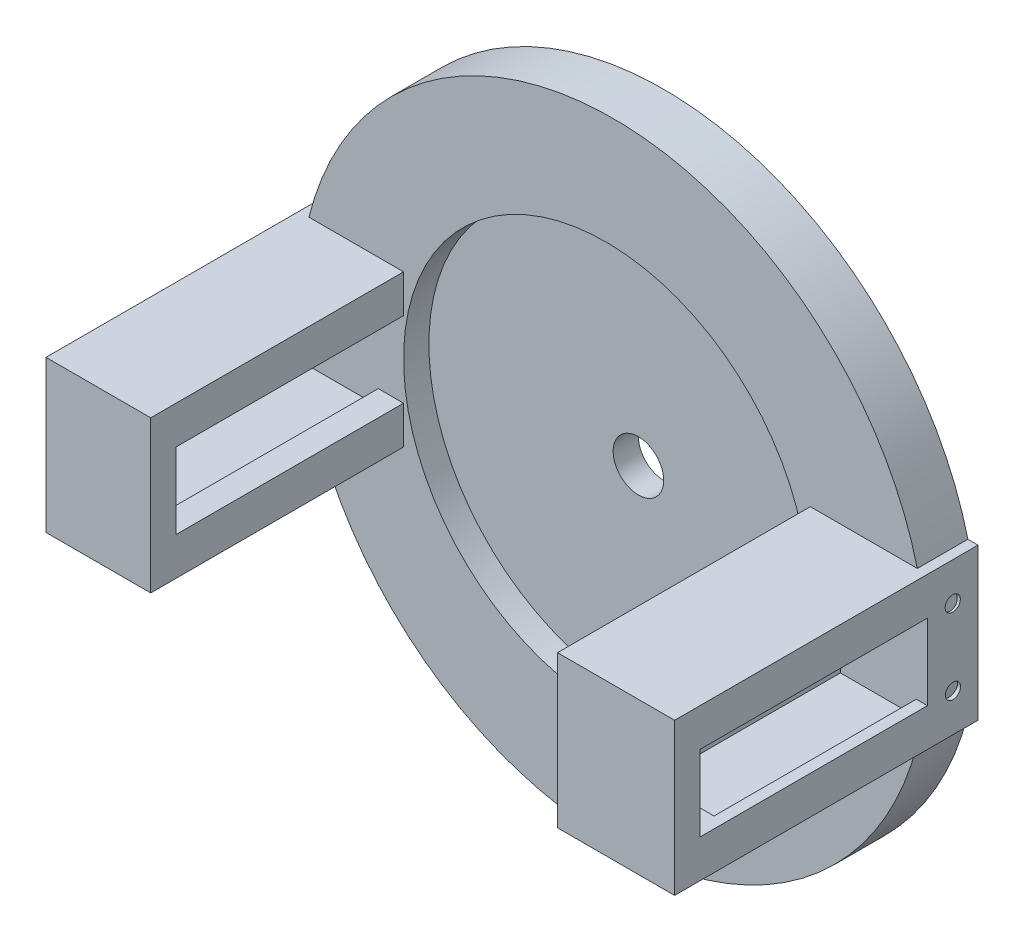
from build123d import *

# Parameters (mm, degrees)
IZIM1_R                     = 62
Y_KSEKLIK_EKSTR_ZYON1_DEPTH = 10
IZIM2_W                     = 60
IZIM2_H                     = 30
IZIM2_R                     = 1.5
IZIM2_W_2                   = 45
IZIM2_H_2                   = 15
Y_KSEKLIK_EKSTR_ZYON2_DEPTH = 25
DAIRESEL_KAPLAMA1_COUNT     = 2
DAIRESEL_KAPLAMA1_ANGLE     = 180
KES_EKSTR_ZYON1_START       = -3
IZIM4_W                     = 15
IZIM4_H                     = 40
KES_EKSTR_ZYON1_DEPTH       = 21
DAIRESEL_KAPLAMA2_COUNT     = 2
IZIM6_W                     = 4.288055231
IZIM6_H                     = 60
IZIM6_W_2                   = 1.841875029
KES_EKSTR_ZYON3_DEPTH       = 20
IZIM5_R                     = 40
KES_EKSTR_ZYON4_DEPTH       = 5
IZIM7_R                     = 5
KES_EKSTR_ZYON5_DEPTH       = 10


with BuildPart() as part:
    # Çizim1 → Yükseklik-Ekstrüzyon1 (new body)
    with BuildSketch(Plane.XY):
        Circle(IZIM1_R)
    extrude(amount=Y_KSEKLIK_EKSTR_ZYON1_DEPTH)

    # Çizim2 → Yükseklik-Ekstrüzyon2 (add)
    with BuildSketch(Plane(origin=(64, 0, 0), x_dir=(0, 0, -1), z_dir=(1, 0, 0))):
        with Locations((-30, 0)):
            Rectangle(IZIM2_W, IZIM2_H)
        with Locations((-5, 7.5)):
            Circle(IZIM2_R, mode=Mode.SUBTRACT)
        with Locations((-4.950442225, -7.5)):
            Circle(IZIM2_R, mode=Mode.SUBTRACT)
        with Locations((-32.5, 0)):
            Rectangle(IZIM2_W_2, IZIM2_H_2, mode=Mode.SUBTRACT)
    y_kseklik_ekstr_zyon2 = extrude(amount=-Y_KSEKLIK_EKSTR_ZYON2_DEPTH)

    # Dairesel Kaplama1: Yükseklik-Ekstrüzyon2 ×2 about axis
    dairesel_kaplama1_axis = Axis((-1.223090101, 0, 0), (0, 0, 1))
    for i in range(1, DAIRESEL_KAPLAMA1_COUNT):
        add(y_kseklik_ekstr_zyon2.rotate(dairesel_kaplama1_axis, i * DAIRESEL_KAPLAMA1_ANGLE / (DAIRESEL_KAPLAMA1_COUNT - 1)))

    # Çizim4 → Kes-Ekstrüzyon1 (cut)
    with BuildSketch(Plane.XZ.offset(-7.5).offset(KES_EKSTR_ZYON1_START)):
        with Locations((-53.946180202, 30)):
            Rectangle(IZIM4_W, IZIM4_H)
    kes_ekstr_zyon1 = extrude(amount=KES_EKSTR_ZYON1_DEPTH, mode=Mode.SUBTRACT)

    # Dairesel Kaplama2: Kes-Ekstrüzyon1 ×2 about axis
    dairesel_kaplama2_axis = Axis((-0.749102638, 0, 0), (0, 0, 1))
    for i in range(1, DAIRESEL_KAPLAMA2_COUNT):
        add(kes_ekstr_zyon1.rotate(dairesel_kaplama2_axis, i * 360 / DAIRESEL_KAPLAMA2_COUNT), mode=Mode.SUBTRACT)

    # Çizim6 → Kes-Ekstrüzyon3 (cut, symmetric)
    with BuildSketch(Plane(origin=(0, 0, 0), x_dir=(1, 0, 0), z_dir=(0, 1, 0))):
        with Locations((-64.302152587, -30)):
            Rectangle(IZIM6_W, IZIM6_H)
        with Locations((63.079062486, -30)):
            Rectangle(IZIM6_W_2, IZIM6_H)
    extrude(amount=KES_EKSTR_ZYON3_DEPTH, both=True, mode=Mode.SUBTRACT)

    # Çizim5 → Kes-Ekstrüzyon4 (cut)
    with BuildSketch(Plane.XY.offset(10)):
        with Locations((-1.443493492, 0.137209833)):
            Circle(IZIM5_R)
    extrude(amount=-KES_EKSTR_ZYON4_DEPTH, mode=Mode.SUBTRACT)

    # Çizim7 → Kes-Ekstrüzyon5 (cut)
    with BuildSketch(Plane(origin=(0, 0, 0), x_dir=(-1, 0, 0), z_dir=(0, 0, -1))):
        Circle(IZIM7_R)
    extrude(amount=-KES_EKSTR_ZYON5_DEPTH, mode=Mode.SUBTRACT)


solid = part.part
